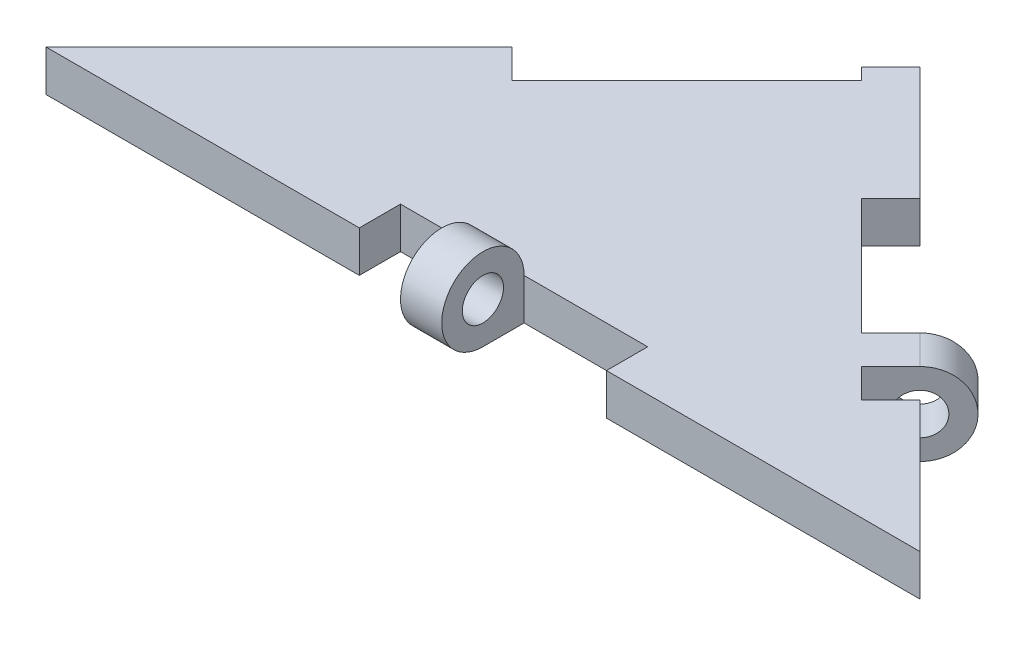
from build123d import *

# Parameters (mm, degrees)
BOSS_EXTRUDE1_DEPTH = 5
SKETCH2_W           = 30
SKETCH2_H           = 5
CUT_EXTRUDE1_DEPTH  = 5
CUT_EXTRUDE2_DEPTH  = 5
BOSS_EXTRUDE2_START = 15
BOSS_EXTRUDE2_DEPTH = 5
BOSS_EXTRUDE3_START = 5
BOSS_EXTRUDE3_DEPTH = 5
CUT_EXTRUDE3_DEPTH  = 10


with BuildPart() as part:
    # Sketch1 → Boss-Extrude1 (new body)
    with BuildSketch(Plane(origin=(0, 0, 0), x_dir=(1, 0, 0), z_dir=(0, 1, 0))):
        Polygon((-53.033008589, 0), (53.033008589, 0), (0, 53.033008589), align=None)
    extrude(amount=BOSS_EXTRUDE1_DEPTH)

    # Sketch2 → Cut-Extrude1 (cut)
    with BuildSketch(Plane(origin=(0, 5, 0), x_dir=(1, 0, 0), z_dir=(0, 1, 0))):
        with Locations((0, 2.5)):
            Rectangle(SKETCH2_W, SKETCH2_H)
        Polygon((-3.535533906, 49.497474683), (-24.748737342, 28.284271247), (-21.213203436, 24.748737342), (0, 45.961940777), align=None)
    extrude(amount=-CUT_EXTRUDE1_DEPTH, mode=Mode.SUBTRACT)

    # Sketch3 → Cut-Extrude2 (cut)
    with BuildSketch(Plane.XZ):
        Polygon((15.909902577, -37.123106012), (37.123106012, -15.909902577), (33.587572106, -12.374368671), (12.374368671, -33.587572106), align=None)
    extrude(amount=-CUT_EXTRUDE2_DEPTH, mode=Mode.SUBTRACT)

    # Sketch5 → Boss-Extrude2 (add)
    with BuildSketch(Plane.ZY.offset(-15).offset(BOSS_EXTRUDE2_START)):
        with BuildLine():
            Line((-2.5, 5), (-5, 5))
            ThreePointArc((-5, 5), (-3.535533906, 1.464466094), (0, 0))
            Line((0, 0), (0, 2.5))
            ThreePointArc((0, 2.5), (-1.767766953, 3.232233047), (-2.5, 5))
        make_face()
        with BuildLine():
            ThreePointArc((0, 0), (3.535533906, 1.464466094), (5, 5))
            ThreePointArc((5, 5), (0, 10), (-5, 5))
            Line((-5, 5), (-2.5, 5))
            ThreePointArc((-2.5, 5), (0, 7.5), (2.5, 5))
            ThreePointArc((2.5, 5), (1.767766953, 3.232233047), (0, 2.5))
            Line((0, 2.5), (0, 0))
        make_face()
        with BuildLine():
            ThreePointArc((0, 0), (-3.535533906, 1.464466094), (-5, 5))
            Line((-5, 5), (-5, 0))
            Line((-5, 0), (0, 0))
        make_face()
    extrude(amount=BOSS_EXTRUDE2_DEPTH)

    # Sketch6 → Boss-Extrude3 (add)
    with BuildSketch(Plane(origin=(10.606601718, 0, 10.606601718), x_dir=(-0.7071067811865478, 0, 0.7071067811865472), z_dir=(-0.7071067811865472, 0, -0.7071067811865478)).offset(BOSS_EXTRUDE3_START)):
        with BuildLine():
            ThreePointArc((-37.5, 5), (-41.035533906, -3.535533906), (-32.5, 0))
            Line((-32.5, 0), (-35, 0))
            ThreePointArc((-35, 0), (-39.267766953, -1.767766953), (-37.5, 2.5))
            Line((-37.5, 2.5), (-37.5, 5))
        make_face()
        with BuildLine():
            Line((-35, 0), (-32.5, 0))
            ThreePointArc((-32.5, 0), (-33.964466094, 3.535533906), (-37.5, 5))
            Line((-37.5, 5), (-37.5, 2.5))
            ThreePointArc((-37.5, 2.5), (-35.732233047, 1.767766953), (-35, 0))
        make_face()
        with BuildLine():
            ThreePointArc((-37.5, 5), (-33.964466094, 3.535533906), (-32.5, 0))
            Line((-32.5, 0), (-32.5, 5))
            Line((-32.5, 5), (-37.5, 5))
        make_face()
    extrude(amount=BOSS_EXTRUDE3_DEPTH)

    # Sketch7 → Cut-Extrude3 (cut)
    with BuildSketch(Plane.XZ):
        Polygon((-21.154129879, -31.87887871), (0, -53.033008589), (2.121320344, -50.911688245), (-19.032809536, -29.757558366), align=None)
    extrude(amount=-CUT_EXTRUDE3_DEPTH, mode=Mode.SUBTRACT)


solid = part.part
